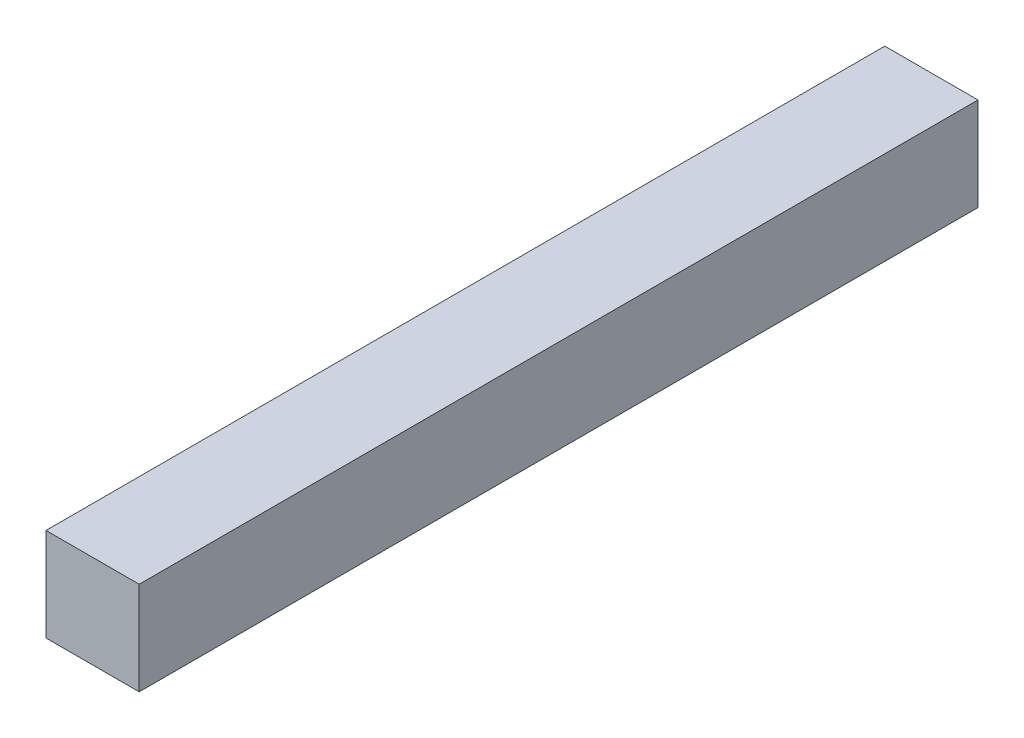
from build123d import *

# Parameters (mm, degrees)
CROQUIS1_W              = 450
CROQUIS1_H              = 50
SALIENTE_EXTRUIR1_DEPTH = 50


with BuildPart() as part:
    # Croquis1 → Saliente-Extruir1 (new body)
    with BuildSketch(Plane(origin=(0, 0, 0), x_dir=(0, 0, -1), z_dir=(1, 0, 0))):
        Rectangle(CROQUIS1_W, CROQUIS1_H)
    extrude(amount=SALIENTE_EXTRUIR1_DEPTH)


solid = part.part
